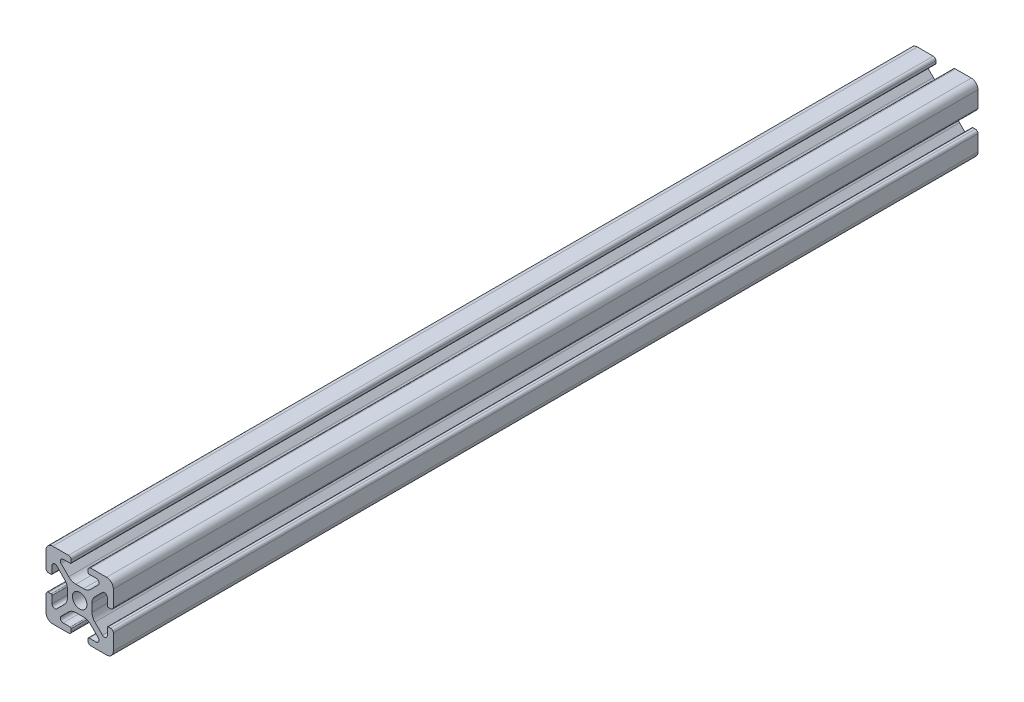
from build123d import *

# Parameters (mm, degrees)
BOSS_EXTRU_1_DEPTH = 256.86


with BuildPart() as part:
    # Esquisse1 → Boss.-Extru.1 (new body)
    with BuildSketch(Plane.XY):
        with BuildLine():
            Line((-3.255887446, 4.528679645), (-5.506192286, 6.778984485))
            ThreePointArc((-5.506192286, 6.778984485), (-5.686636441, 7.686138511), (-4.917588391, 8.199999989))
            Line((-4.917588391, 8.199999989), (-2.799999991, 8.199999989))
            ThreePointArc((-2.799999991, 8.199999989), (-2.587867957, 8.287867955), (-2.499999991, 8.499999989))
            Line((-2.499999991, 8.499999989), (-2.499999991, 9.199999989))
            ThreePointArc((-2.499999991, 9.199999989), (-2.734314566, 9.765685414), (-3.299999991, 9.999999989))
            Line((-3.299999991, 9.999999989), (-7.999999991, 9.999999989))
            ThreePointArc((-7.999999991, 9.999999989), (-9.414213554, 9.414213552), (-9.999999991, 7.999999989))
            Line((-9.999999991, 7.999999989), (-9.999999991, 3.299999989))
            ThreePointArc((-9.999999991, 3.299999989), (-9.765685416, 2.734314564), (-9.199999991, 2.499999989))
            Line((-9.199999991, 2.499999989), (-8.499999991, 2.499999989))
            ThreePointArc((-8.499999991, 2.499999989), (-8.287867957, 2.587867955), (-8.199999991, 2.799999989))
            Line((-8.199999991, 2.799999989), (-8.199999991, 4.917588389))
            ThreePointArc((-8.199999991, 4.917588389), (-7.686138517, 5.686636433), (-6.778984497, 5.506192279))
            Line((-6.778984497, 5.506192279), (-4.528679657, 3.255887439))
            ThreePointArc((-4.528679657, 3.255887439), (-3.878361403, 2.282617393), (-3.650000001, 1.134567096))
            Line((-3.650000001, 1.134567096), (-3.650000001, -1.134567114))
            ThreePointArc((-3.650000001, -1.134567114), (-3.878361403, -2.282617409), (-4.528679656, -3.255887454))
            Line((-4.528679656, -3.255887454), (-6.778984496, -5.506192294))
            ThreePointArc((-6.778984496, -5.506192294), (-7.686138522, -5.686636449), (-8.2, -4.9175884))
            Line((-8.2, -4.9175884), (-8.2, -2.8))
            ThreePointArc((-8.2, -2.8), (-8.287867966, -2.587867966), (-8.5, -2.5))
            Line((-8.5, -2.5), (-9.2, -2.5))
            ThreePointArc((-9.2, -2.5), (-9.765685425, -2.734314575), (-10, -3.3))
            Line((-10, -3.3), (-10, -8))
            ThreePointArc((-10, -8), (-9.414213562, -9.414213562), (-8, -10))
            Line((-8, -10), (-3.3, -10))
            ThreePointArc((-3.3, -10), (-2.734314575, -9.765685425), (-2.5, -9.2))
            Line((-2.5, -9.2), (-2.5, -8.5))
            ThreePointArc((-2.5, -8.5), (-2.587867966, -8.287867966), (-2.8, -8.2))
            Line((-2.8, -8.2), (-4.9175884, -8.2))
            ThreePointArc((-4.9175884, -8.2), (-5.686636444, -7.686138526), (-5.50619229, -6.778984506))
            Line((-5.50619229, -6.778984506), (-3.25588745, -4.528679666))
            ThreePointArc((-3.25588745, -4.528679666), (-2.282617404, -3.878361412), (-1.134567106, -3.650000009))
            Line((-1.134567106, -3.650000009), (1.134567104, -3.650000009))
            ThreePointArc((1.134567104, -3.650000009), (2.282617399, -3.878361412), (3.255887444, -4.528679664))
            Line((3.255887444, -4.528679664), (5.506192284, -6.778984504))
            ThreePointArc((5.506192284, -6.778984504), (5.686636439, -7.686138531), (4.917588389, -8.200000009))
            Line((4.917588389, -8.200000009), (2.799999989, -8.200000009))
            ThreePointArc((2.799999989, -8.200000009), (2.587867955, -8.287867974), (2.499999989, -8.500000009))
            Line((2.499999989, -8.500000009), (2.499999989, -9.200000009))
            ThreePointArc((2.499999989, -9.200000009), (2.734314564, -9.765685434), (3.299999989, -10.000000009))
            Line((3.299999989, -10.000000009), (7.999999989, -10.000000009))
            ThreePointArc((7.999999989, -10.000000009), (9.414213552, -9.414213571), (9.999999989, -8.000000009))
            Line((9.999999989, -8.000000009), (9.999999989, -3.300000009))
            ThreePointArc((9.999999989, -3.300000009), (9.765685414, -2.734314584), (9.199999989, -2.500000009))
            Line((9.199999989, -2.500000009), (8.499999989, -2.500000009))
            ThreePointArc((8.499999989, -2.500000009), (8.287867955, -2.587867974), (8.199999989, -2.800000009))
            Line((8.199999989, -2.800000009), (8.199999989, -4.917588409))
            ThreePointArc((8.199999989, -4.917588409), (7.686138515, -5.686636452), (6.778984495, -5.506192299))
            Line((6.778984495, -5.506192299), (4.528679655, -3.255887459))
            ThreePointArc((4.528679655, -3.255887459), (3.878361401, -2.282617412), (3.649999999, -1.134567115))
            Line((3.649999999, -1.134567115), (3.649999999, 1.134567095))
            ThreePointArc((3.649999999, 1.134567095), (3.878361401, 2.28261739), (4.528679654, 3.255887435))
            Line((4.528679654, 3.255887435), (6.778984494, 5.506192275))
            ThreePointArc((6.778984494, 5.506192275), (7.68613852, 5.68663643), (8.199999998, 4.917588381))
            Line((8.199999998, 4.917588381), (8.199999998, 2.799999981))
            ThreePointArc((8.199999998, 2.799999981), (8.287867964, 2.587867946), (8.499999998, 2.499999981))
            Line((8.499999998, 2.499999981), (9.199999998, 2.499999981))
            ThreePointArc((9.199999998, 2.499999981), (9.765685423, 2.734314556), (9.999999998, 3.299999981))
            Line((9.999999998, 3.299999981), (9.999999998, 7.999999981))
            ThreePointArc((9.999999998, 7.999999981), (9.41421356, 9.414213543), (7.999999998, 9.999999981))
            Line((7.999999998, 9.999999981), (3.299999998, 9.999999981))
            ThreePointArc((3.299999998, 9.999999981), (2.734314573, 9.765685406), (2.499999998, 9.199999981))
            Line((2.499999998, 9.199999981), (2.499999998, 8.499999981))
            ThreePointArc((2.499999998, 8.499999981), (2.587867964, 8.287867946), (2.799999998, 8.199999981))
            Line((2.799999998, 8.199999981), (4.917588398, 8.199999981))
            ThreePointArc((4.917588398, 8.199999981), (5.686636442, 7.686138507), (5.506192288, 6.778984487))
            Line((5.506192288, 6.778984487), (3.255887448, 4.528679647))
            ThreePointArc((3.255887448, 4.528679647), (2.282617402, 3.878361393), (1.134567104, 3.64999999))
            Line((1.134567104, 3.64999999), (-1.134567106, 3.64999999))
            ThreePointArc((-1.134567106, 3.64999999), (-2.282617401, 3.878361392), (-3.255887446, 4.528679645))
        make_face()
        with BuildLine():
            ThreePointArc((-2.15, 0), (0, -2.15), (2.15, 0))
            ThreePointArc((2.15, 0), (0, 2.15), (-2.15, 0))
        make_face(mode=Mode.SUBTRACT)
    extrude(amount=BOSS_EXTRU_1_DEPTH)


solid = part.part
